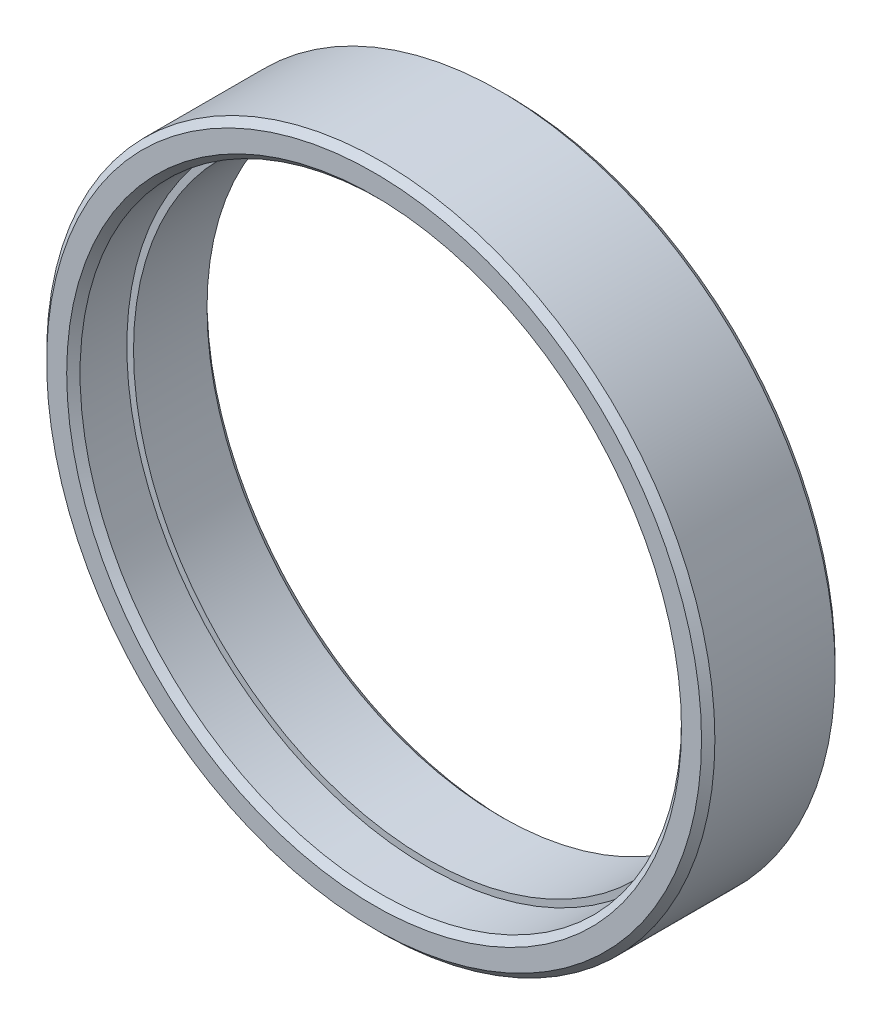
from build123d import *

# Parameters (mm, degrees)
SKETCH_1_R          = 50
SKETCH_1_R_2        = 44
EXTRUDE_1_DEPTH     = 10
SKETCH_2_R          = 45
CUT_EXTRUDE_1_DEPTH = 8
CHAMFER_1_SIZE      = 1


with BuildPart() as part:
    # 스케치1 → 보스-돌출1 (new, symmetric)
    with BuildSketch(Plane.XY):
        Circle(SKETCH_1_R)
        Circle(SKETCH_1_R_2, mode=Mode.SUBTRACT)
    extrude(amount=EXTRUDE_1_DEPTH, both=True)

    # 스케치2 → 컷-돌출1 (cut)
    with BuildSketch(Plane.XY.offset(10)):
        Circle(SKETCH_2_R)
    extrude(amount=-CUT_EXTRUDE_1_DEPTH, mode=Mode.SUBTRACT)

    # 모따기1
    chamfer_1_edges = [part.edges().sort_by_distance(p)[0] for p in [
        (-45, 0, 10),
        (-50, 0, -10),
        (-50, 0, 10),
        (-44, 0, -10),
    ]]
    chamfer(chamfer_1_edges, length=CHAMFER_1_SIZE)


solid = part.part
